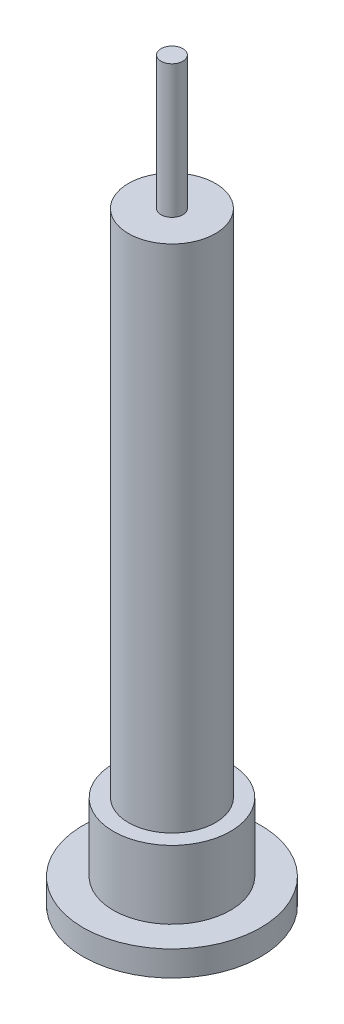
from build123d import *


with BuildPart() as part:
    # Sketch1 → Revolve1 (revolve)
    with BuildSketch(Plane.XY, mode=Mode.PRIVATE) as revolve1_sk:
        Polygon((0, 0), (3, 0), (3, 1.936027853), (10, 1.936027853), (10, 4.776027853), (6.6, 4.776027853), (6.6, 12.476027853), (4.9, 12.476027853), (4.9, 69.952466449), (1.228586646, 69.952466449), (1.228586646, 84.936027853), (0, 84.936027853), align=None)
    revolve(revolve1_sk.sketch.rotate(Axis((0, 84.936027853, 0), (0, -1, 0)), 90), axis=Axis((0, 84.936027853, 0), (0, -1, 0)))


solid = part.part
